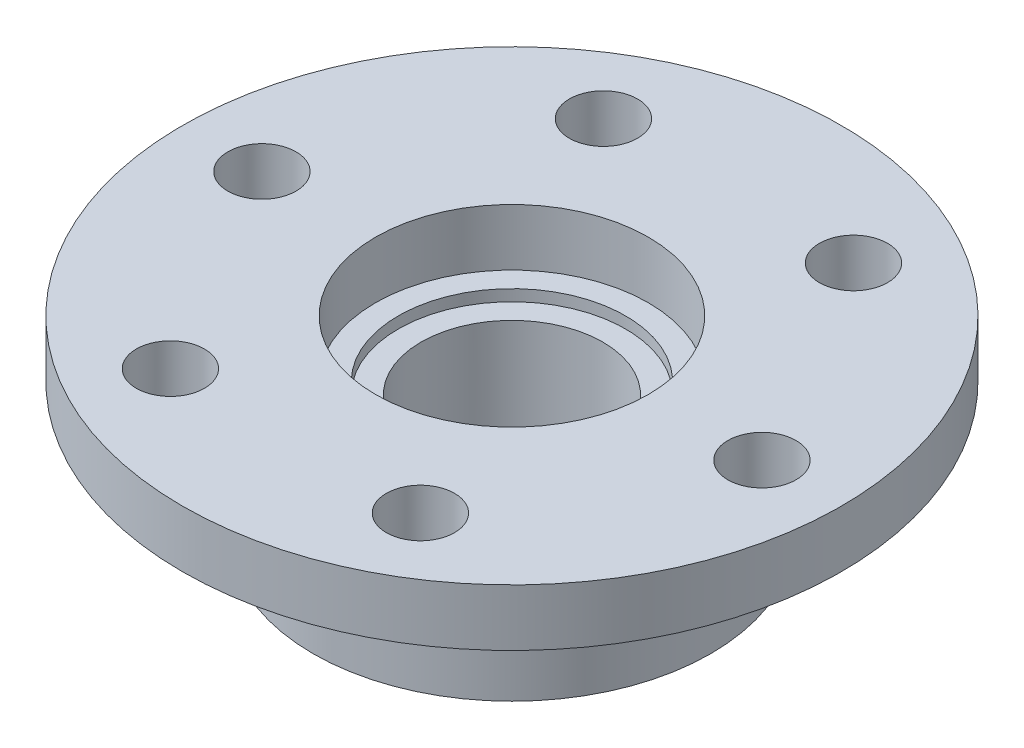
from build123d import *

# Parameters (mm, degrees)
SKETCH1_R           = 17.5
BOSS_EXTRUDE1_DEPTH = 12
SKETCH2_R           = 29
BOSS_EXTRUDE2_DEPTH = 5
SKETCH3_R           = 12
CUT_EXTRUDE1_DEPTH  = 5
SKETCH4_R           = 10
CUT_EXTRUDE2_DEPTH  = 1
CUT_EXTRUDE3_REACH  = 44.732
SKETCH5_R           = 3
BOSS_EXTRUDE3_START = 0.9
SKETCH6_R           = 18.8
SKETCH6_R_2         = 17.5
BOSS_EXTRUDE3_DEPTH = 0.9
CUT_EXTRUDE4_REACH  = 46.396
SKETCH7_R           = 8
SKETCH9_R           = 2.7
CUT_EXTRUDE5_DEPTH  = 10


with BuildPart() as part:
    # Sketch1 → Boss-Extrude1 (new body)
    with BuildSketch(Plane(origin=(0, 0, 0), x_dir=(1, 0, 0), z_dir=(0, 1, 0))):
        with Locations(Location((0, 0, 0), (0, 0, 270))):
            Circle(SKETCH1_R)
    extrude(amount=BOSS_EXTRUDE1_DEPTH)

    # Sketch2 → Boss-Extrude2 (add)
    with BuildSketch(Plane(origin=(0, 12, 0), x_dir=(1, 0, 0), z_dir=(0, 1, 0))):
        with Locations(Location((0, 0, 0), (0, 0, 270))):
            Circle(SKETCH2_R)
    extrude(amount=BOSS_EXTRUDE2_DEPTH)

    # Sketch3 → Cut-Extrude1 (cut)
    with BuildSketch(Plane(origin=(0, 17, 0), x_dir=(1, 0, 0), z_dir=(0, 1, 0))):
        with Locations(Location((0, 0, 0), (0, 0, 270))):
            Circle(SKETCH3_R)
    extrude(amount=-CUT_EXTRUDE1_DEPTH, mode=Mode.SUBTRACT)

    # Sketch4 → Cut-Extrude2 (cut)
    with BuildSketch(Plane(origin=(0, 12, 0), x_dir=(1, 0, 0), z_dir=(0, 1, 0))):
        with Locations(Location((0, 0, 0), (0, 0, 270))):
            Circle(SKETCH4_R)
    extrude(amount=-CUT_EXTRUDE2_DEPTH, mode=Mode.SUBTRACT)

    # Sketch5 → Cut-Extrude3 (cut, up to next)
    with BuildSketch(Plane.XZ.offset(-12), mode=Mode.PRIVATE) as cut_extrude3_sk1:
        with Locations(Location((22, 0, 0), (0, 0, 270))):
            Circle(SKETCH5_R)
    cut_extrude3_tool1 = extrude(cut_extrude3_sk1.sketch, amount=-CUT_EXTRUDE3_REACH, mode=Mode.PRIVATE) & part.part
    # Sketch5 → Cut-Extrude3 (cut, up to next)
    with BuildSketch(Plane.XZ.offset(-12), mode=Mode.PRIVATE) as cut_extrude3_sk2:
        with Locations(Location((11, -19.052558883, 0), (0, 0, 270))):
            Circle(SKETCH5_R)
    cut_extrude3_tool2 = extrude(cut_extrude3_sk2.sketch, amount=-CUT_EXTRUDE3_REACH, mode=Mode.PRIVATE) & part.part
    # Sketch5 → Cut-Extrude3 (cut, up to next)
    with BuildSketch(Plane.XZ.offset(-12), mode=Mode.PRIVATE) as cut_extrude3_sk3:
        with Locations(Location((-11, -19.052558883, 0), (0, 0, 270))):
            Circle(SKETCH5_R)
    cut_extrude3_tool3 = extrude(cut_extrude3_sk3.sketch, amount=-CUT_EXTRUDE3_REACH, mode=Mode.PRIVATE) & part.part
    # Sketch5 → Cut-Extrude3 (cut, up to next)
    with BuildSketch(Plane.XZ.offset(-12), mode=Mode.PRIVATE) as cut_extrude3_sk4:
        with Locations(Location((-22, 0, 0), (0, 0, 270))):
            Circle(SKETCH5_R)
    cut_extrude3_tool4 = extrude(cut_extrude3_sk4.sketch, amount=-CUT_EXTRUDE3_REACH, mode=Mode.PRIVATE) & part.part
    # Sketch5 → Cut-Extrude3 (cut, up to next)
    with BuildSketch(Plane.XZ.offset(-12), mode=Mode.PRIVATE) as cut_extrude3_sk5:
        with Locations(Location((-11, 19.052558883, 0), (0, 0, 270))):
            Circle(SKETCH5_R)
    cut_extrude3_tool5 = extrude(cut_extrude3_sk5.sketch, amount=-CUT_EXTRUDE3_REACH, mode=Mode.PRIVATE) & part.part
    # Sketch5 → Cut-Extrude3 (cut, up to next)
    with BuildSketch(Plane.XZ.offset(-12), mode=Mode.PRIVATE) as cut_extrude3_sk6:
        with Locations(Location((11, 19.052558883, 0), (0, 0, 270))):
            Circle(SKETCH5_R)
    cut_extrude3_tool6 = extrude(cut_extrude3_sk6.sketch, amount=-CUT_EXTRUDE3_REACH, mode=Mode.PRIVATE) & part.part
    add(cut_extrude3_tool1.solids().sort_by_distance((22, 12, 0))[0], mode=Mode.SUBTRACT)
    add(cut_extrude3_tool2.solids().sort_by_distance((11, 12, -19.052559))[0], mode=Mode.SUBTRACT)
    add(cut_extrude3_tool3.solids().sort_by_distance((-11, 12, -19.052559))[0], mode=Mode.SUBTRACT)
    add(cut_extrude3_tool4.solids().sort_by_distance((-22, 12, 0))[0], mode=Mode.SUBTRACT)
    add(cut_extrude3_tool5.solids().sort_by_distance((-11, 12, 19.052559))[0], mode=Mode.SUBTRACT)
    add(cut_extrude3_tool6.solids().sort_by_distance((11, 12, 19.052559))[0], mode=Mode.SUBTRACT)

    # Sketch6 → Boss-Extrude3 (add)
    with BuildSketch(Plane.XZ.offset(-12).offset(BOSS_EXTRUDE3_START)):
        with Locations(Location((0, 0, 0), (0, 0, 90))):
            Circle(SKETCH6_R)
        with Locations(Location((0, 0, 0), (0, 0, 270))):
            Circle(SKETCH6_R_2, mode=Mode.SUBTRACT)
    extrude(amount=-BOSS_EXTRUDE3_DEPTH)

    # Sketch7 → Cut-Extrude4 (cut, up to next)
    with BuildSketch(Plane.XZ, mode=Mode.PRIVATE) as cut_extrude4_sk1:
        with Locations(Location((0, 0, 0), (0, 0, 270))):
            Circle(SKETCH7_R)
    cut_extrude4_tool1 = extrude(cut_extrude4_sk1.sketch, amount=-CUT_EXTRUDE4_REACH, mode=Mode.PRIVATE) & part.part
    add(cut_extrude4_tool1.solids().sort_by_distance((0, 0, 0))[0], mode=Mode.SUBTRACT)

    # Sketch9 → Cut-Extrude5 (cut)
    with BuildSketch(Plane.XZ):
        with Locations(Location((0, 12.75, 0), (0, 0, 270))):
            Circle(SKETCH9_R)
        with Locations(Location((11.041823898, 6.375, 0), (0, 0, 270))):
            Circle(SKETCH9_R)
        with Locations(Location((11.041823898, -6.375, 0), (0, 0, 270))):
            Circle(SKETCH9_R)
        with Locations(Location((0, -12.75, 0), (0, 0, 270))):
            Circle(SKETCH9_R)
        with Locations(Location((-11.041823898, -6.375, 0), (0, 0, 270))):
            Circle(SKETCH9_R)
        with Locations(Location((-11.041823898, 6.375, 0), (0, 0, 270))):
            Circle(SKETCH9_R)
    extrude(amount=-CUT_EXTRUDE5_DEPTH, mode=Mode.SUBTRACT)


solid = part.part
